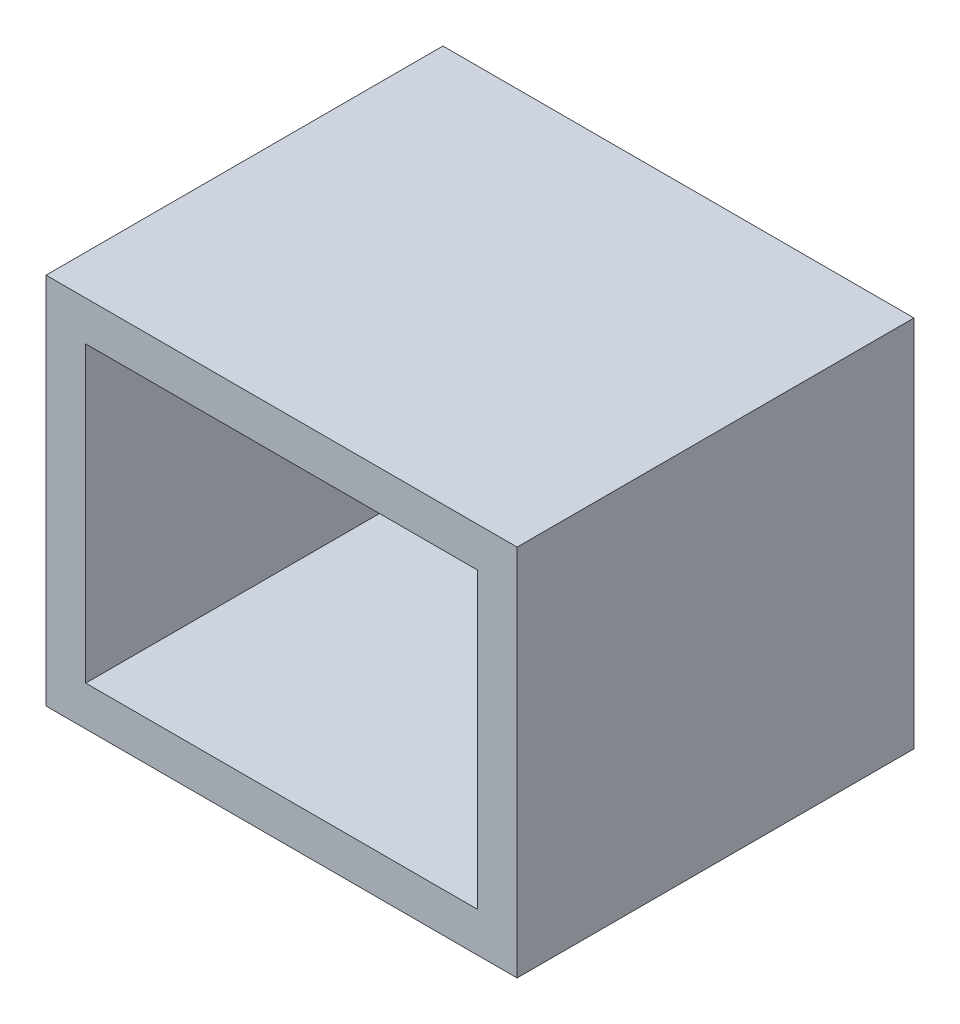
from build123d import *

# Parameters (mm, degrees)
SKETCH2_W           = 30.14581014
SKETCH2_H           = 23.882232645
SKETCH2_W_2         = 25.06581014
SKETCH2_H_2         = 18.802232645
BOSS_EXTRUDE1_DEPTH = 25.4


with BuildPart() as part:
    # Sketch2 → Boss-Extrude1 (new body)
    with BuildSketch(Plane.XY):
        with Locations((15.07290507, 11.941116323)):
            Rectangle(SKETCH2_W, SKETCH2_H)
        with Locations((15.07290507, 11.941116323)):
            Rectangle(SKETCH2_W_2, SKETCH2_H_2, mode=Mode.SUBTRACT)
    extrude(amount=BOSS_EXTRUDE1_DEPTH)


solid = part.part
